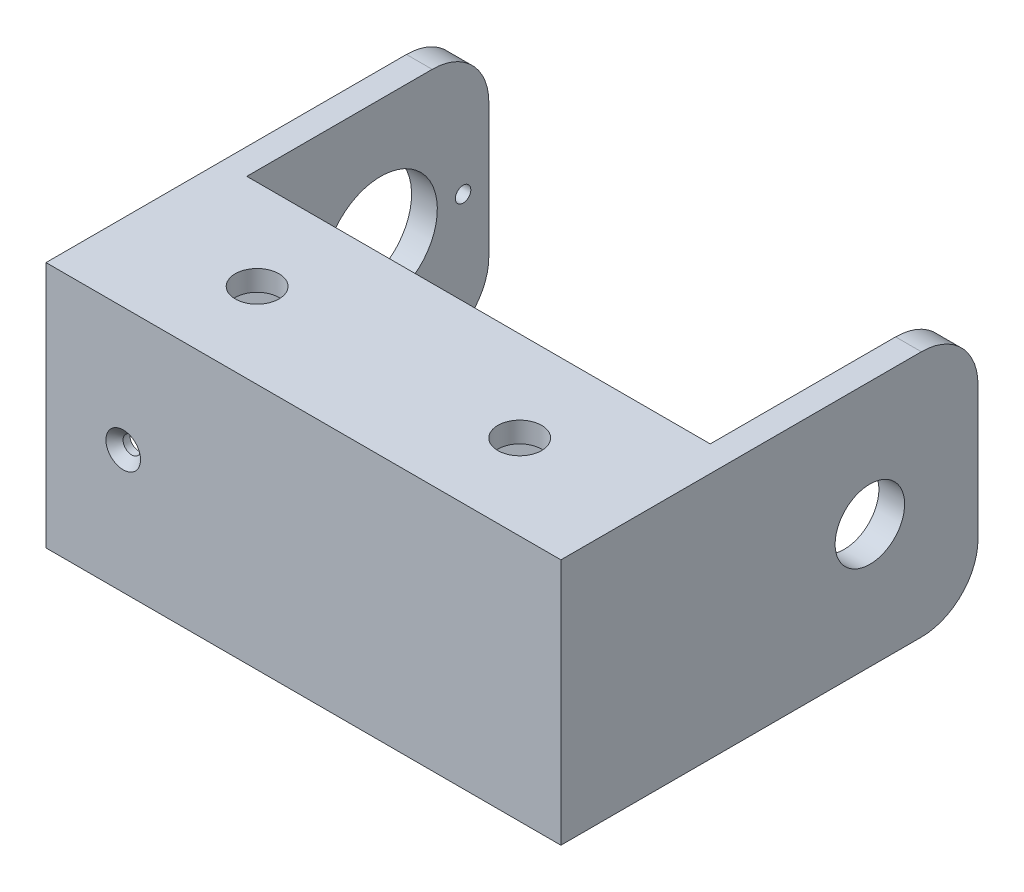
from build123d import *

# Parameters (mm, degrees)
ESBO_O1_W                            = 48
ESBO_O1_H                            = 120
RESSALTO_EXTRUS_O1_DEPTH             = 3
RESSALTO_EXTRUS_O2_DEPTH             = 28
ESBO_O3_W                            = 120
ESBO_O3_H                            = 48
RESSALTO_EXTRUS_O3_DEPTH             = 3
ESBO_O4_W                            = 5
ESBO_O4_H                            = 48
RESSALTO_EXTRUS_O4_DEPTH             = 47
ESBO_O5_R                            = 11
CORTE_EXTRUS_O1_DEPTH                = 5
ESBO_O6_R                            = 4.25
CORTE_EXTRUS_O2_DEPTH                = 110.489725545
FILETE1_R                            = 11
ESBO_O7_R                            = 6.75
CORTE_EXTRUS_O3_DEPTH                = 142.014183684
ESBO_O8_W                            = 20
ESBO_O8_H                            = 48
CORTE_EXTRUS_O4_DEPTH                = 80.906195004
ESBO_O12_R                           = 1.5
CORTE_EXTRUS_O5_DEPTH                = 3
ESCAREADO_PARA_SFHCS_M31_D           = 3.4
ESCAREADO_PARA_SFHCS_M31_DEPTH       = 3
ESCAREADO_PARA_SFHCS_M31_CSINK_D     = 6.72
ESCAREADO_PARA_SFHCS_M31_CSINK_ANGLE = 90
ESCAREADO_PARA_SFHCS_M31_TIP         = 1.021463052
ESBO_O18_R                           = 1.5
CORTE_EXTRUS_O6_DEPTH                = 5


with BuildPart() as part:
    # Esboço1 → Ressalto-extrusão1 (new body)
    with BuildSketch(Plane(origin=(0, 0, 0), x_dir=(0, 1, 0), z_dir=(0, 0, 1))):
        Rectangle(ESBO_O1_W, ESBO_O1_H)
    extrude(amount=RESSALTO_EXTRUS_O1_DEPTH)

    # Esboço2 → Ressalto-extrusão2 (add)
    with BuildSketch(Plane(origin=(0, 0, 0), x_dir=(1, 0, 0), z_dir=(0, 0, -1))):
        Polygon((-60, -20), (-60, -24), (60, -24), (60, 24), (-60, 24), (-60, 20), (56, 20), (56, -20), align=None)
    extrude(amount=RESSALTO_EXTRUS_O2_DEPTH)

    # Esboço3 → Ressalto-extrusão3 (add)
    with BuildSketch(Plane(origin=(0, 0, -28), x_dir=(1, 0, 0), z_dir=(0, 0, -1))):
        Rectangle(ESBO_O3_W, ESBO_O3_H)
    extrude(amount=RESSALTO_EXTRUS_O3_DEPTH)

    # Esboço4 → Ressalto-extrusão4 (add)
    with BuildSketch(Plane(origin=(0, 0, -31), x_dir=(1, 0, 0), z_dir=(0, 0, -1))):
        with Locations((-37.5, 0)):
            Rectangle(ESBO_O4_W, ESBO_O4_H)
        with Locations((57.5, 0)):
            Rectangle(ESBO_O4_W, ESBO_O4_H)
    extrude(amount=RESSALTO_EXTRUS_O4_DEPTH)

    # Esboço5 → Corte-extrusão1 (cut)
    with BuildSketch(Plane(origin=(-40, 0, 0), x_dir=(0, -1, 0), z_dir=(-1, 0, 0))):
        with Locations((0, -57)):
            Circle(ESBO_O5_R)
    extrude(amount=-CORTE_EXTRUS_O1_DEPTH, mode=Mode.SUBTRACT)

    # Esboço6 → Corte-extrusão2 (cut, through all)
    with BuildSketch(Plane.XZ.offset(24)):
        with Locations(Location((-15.5, -13.5, 0), (0, 0, 270))):
            Circle(ESBO_O6_R)
        with Locations(Location((35.5, -13.5, 0), (0, 0, 270))):
            Circle(ESBO_O6_R)
    extrude(amount=-CORTE_EXTRUS_O2_DEPTH, mode=Mode.SUBTRACT)

    # Filete1
    filete1_edges = [part.edges().sort_by_distance(p)[0] for p in [
        (-37.5, 24, -78),
        (-37.5, -24, -78),
        (57.5, -24, -78),
        (57.5, 24, -78),
    ]]
    fillet(filete1_edges, radius=FILETE1_R)

    # Esboço7 → Corte-extrusão3 (cut, through all)
    with BuildSketch(Plane(origin=(55, 0, 0), x_dir=(0, -1, 0), z_dir=(-1, 0, 0))):
        with Locations((0, -57)):
            Circle(ESBO_O7_R)
    extrude(amount=-CORTE_EXTRUS_O3_DEPTH, mode=Mode.SUBTRACT)

    # Esboço8 → Corte-extrusão4 (cut, through all)
    with BuildSketch(Plane(origin=(0, 0, -31), x_dir=(1, 0, 0), z_dir=(0, 0, -1))):
        with Locations((-50, 0)):
            Rectangle(ESBO_O8_W, ESBO_O8_H)
    extrude(amount=-CORTE_EXTRUS_O4_DEPTH, mode=Mode.SUBTRACT)

    # Esboço12 → Corte-extrusão5 (cut)
    with BuildSketch(Plane.XY.offset(3)):
        with Locations((-25, 0)):
            Circle(ESBO_O12_R)
    extrude(amount=-CORTE_EXTRUS_O5_DEPTH, mode=Mode.SUBTRACT)

    # Escareado para SFHCS M31
    with Locations(Plane(origin=(0, 0, 3), x_dir=(0, -1, 0), z_dir=(0, 0, 1))):
        with Locations((0, -25)):
            CounterSinkHole(ESCAREADO_PARA_SFHCS_M31_D / 2, ESCAREADO_PARA_SFHCS_M31_CSINK_D / 2, depth=ESCAREADO_PARA_SFHCS_M31_DEPTH, counter_sink_angle=ESCAREADO_PARA_SFHCS_M31_CSINK_ANGLE)
            with Locations((0, 0, -(ESCAREADO_PARA_SFHCS_M31_DEPTH + ESCAREADO_PARA_SFHCS_M31_TIP / 2))):  # 118° drill point
                Cone(0, ESCAREADO_PARA_SFHCS_M31_D / 2, ESCAREADO_PARA_SFHCS_M31_TIP, mode=Mode.SUBTRACT)

    # Esboço18 → Corte-extrusão6 (cut)
    with BuildSketch(Plane(origin=(-40, 0, 0), x_dir=(0, -1, 0), z_dir=(-1, 0, 0))):
        with Locations((-16, -33)):
            Circle(ESBO_O18_R)
        with Locations((16, -33)):
            Circle(ESBO_O18_R)
        with Locations((0, -73)):
            Circle(ESBO_O18_R)
    extrude(amount=-CORTE_EXTRUS_O6_DEPTH, mode=Mode.SUBTRACT)


solid = part.part
